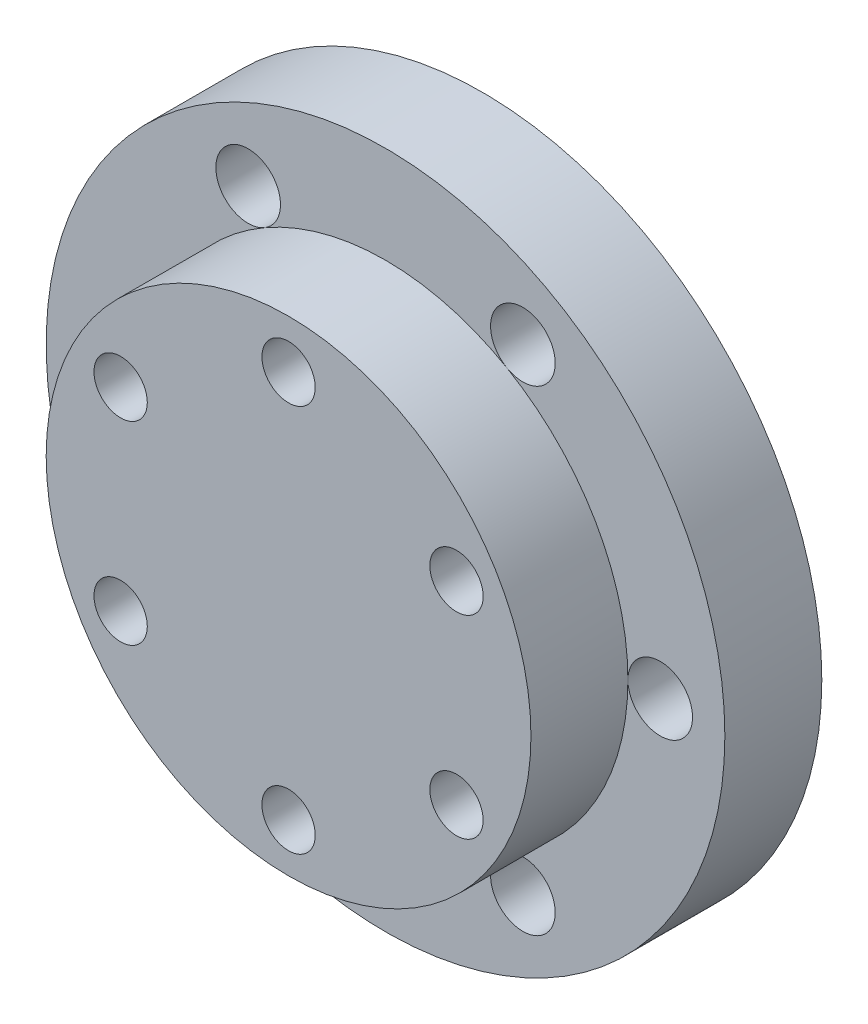
from build123d import *

# Parameters (mm, degrees)
SKETCH1_R                      = 21
SKETCH1_R_2                    = 2
BOSS_EXTRUDE1_DEPTH            = 6
SKETCH2_R                      = 15
BOSS_EXTRUDE2_DEPTH            = 6
F_3_3_3_3_DIAMETER_HOLE1_D     = 3.3
F_3_3_3_3_DIAMETER_HOLE1_DEPTH = 6
F_3_3_3_3_DIAMETER_HOLE1_TIP   = 0.991420021
F_1_2_0_5_DIAMETER_HOLE1_D     = 12.7
F_1_2_0_5_DIAMETER_HOLE1_DEPTH = 6
F_1_2_0_5_DIAMETER_HOLE1_TIP   = 3.815464931


with BuildPart() as part:
    # Sketch1 → Boss-Extrude1 (new body)
    with BuildSketch(Plane(origin=(0, 0, 0), x_dir=(0, 1, 0), z_dir=(0, 0, 1))):
        with Locations(Location((0, 0, 0), (0, 0, 270))):
            Circle(SKETCH1_R)
        with Locations(Location((0, 17, 0), (0, 0, 270))):
            Circle(SKETCH1_R_2, mode=Mode.SUBTRACT)
        with Locations(Location((14.722431864, 8.5, 0), (0, 0, 270))):
            Circle(SKETCH1_R_2, mode=Mode.SUBTRACT)
        with Locations(Location((14.722431864, -8.5, 0), (0, 0, 270))):
            Circle(SKETCH1_R_2, mode=Mode.SUBTRACT)
        with Locations(Location((0, -17, 0), (0, 0, 270))):
            Circle(SKETCH1_R_2, mode=Mode.SUBTRACT)
        with Locations(Location((-14.722431864, -8.5, 0), (0, 0, 270))):
            Circle(SKETCH1_R_2, mode=Mode.SUBTRACT)
        with Locations(Location((-14.722431864, 8.5, 0), (0, 0, 270))):
            Circle(SKETCH1_R_2, mode=Mode.SUBTRACT)
    extrude(amount=BOSS_EXTRUDE1_DEPTH)

    # Sketch2 → Boss-Extrude2 (add)
    with BuildSketch(Plane.XY.offset(6)):
        with Locations(Location((0, 0, 0), (0, 0, 179.99992824))):
            Circle(SKETCH2_R)
    extrude(amount=BOSS_EXTRUDE2_DEPTH)

    # Ø3.3 (3.3) Diameter Hole1
    with Locations(Plane(origin=(-10.392304845, -6, 12), x_dir=(1, 0, 0), z_dir=(0, 0, 1))):
        with Locations((0, 0), (0, 12), (10.392304845, 18), (20.78460969, 12), (20.78460969, 0), (10.392304845, -6)):
            Hole(F_3_3_3_3_DIAMETER_HOLE1_D / 2, depth=F_3_3_3_3_DIAMETER_HOLE1_DEPTH)
            with Locations((0, 0, -(F_3_3_3_3_DIAMETER_HOLE1_DEPTH + F_3_3_3_3_DIAMETER_HOLE1_TIP / 2))):  # 118° drill point
                Cone(0, F_3_3_3_3_DIAMETER_HOLE1_D / 2, F_3_3_3_3_DIAMETER_HOLE1_TIP, mode=Mode.SUBTRACT)

    # 1/2 (0.5) Diameter Hole1
    with Locations(Plane(origin=(0, 0, 0), x_dir=(1, 0, 0), z_dir=(0, 0, -1))):
        with Locations((0, 0)):
            Hole(F_1_2_0_5_DIAMETER_HOLE1_D / 2, depth=F_1_2_0_5_DIAMETER_HOLE1_DEPTH)
            with Locations((0, 0, -(F_1_2_0_5_DIAMETER_HOLE1_DEPTH + F_1_2_0_5_DIAMETER_HOLE1_TIP / 2))):  # 118° drill point
                Cone(0, F_1_2_0_5_DIAMETER_HOLE1_D / 2, F_1_2_0_5_DIAMETER_HOLE1_TIP, mode=Mode.SUBTRACT)


solid = part.part
